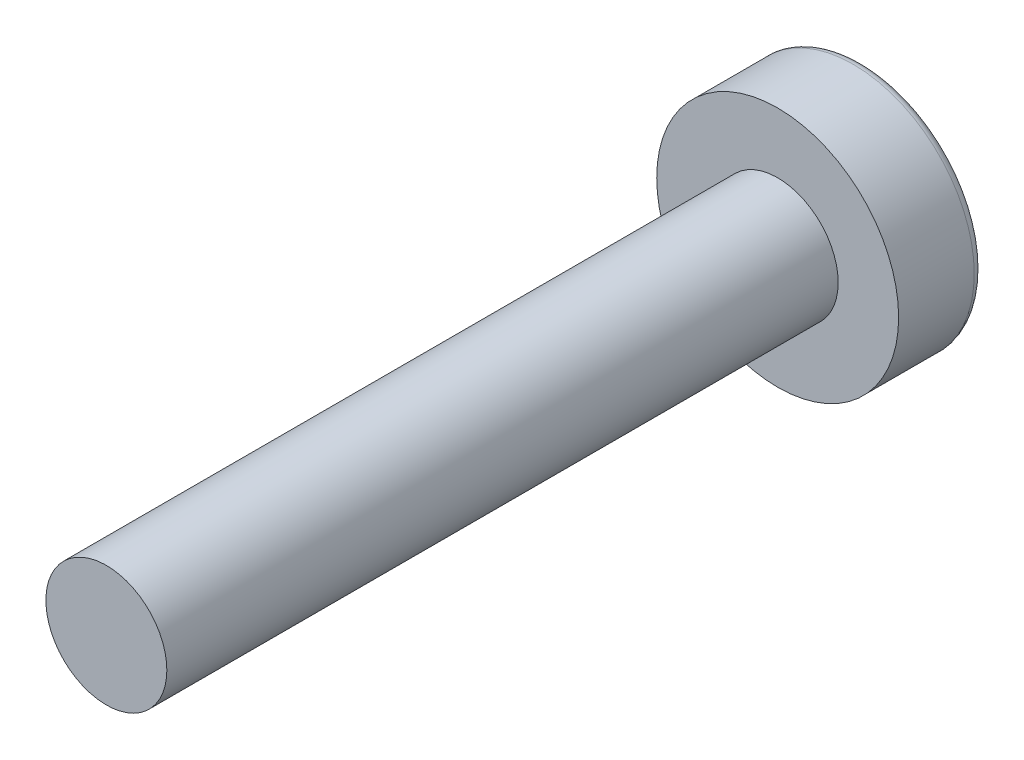
from build123d import *

# Parameters (mm, degrees)
SKETCH_1_R      = 4
EXTRUDE_1_DEPTH = 2.8
SKETCH_2_R      = 2
EXTRUDE_2_DEPTH = 22.2
FILLET_1_R      = 0.3


with BuildPart() as part:
    # 草图1 → 凸台-拉伸1 (new body)
    with BuildSketch(Plane.XY):
        Circle(SKETCH_1_R)
    extrude(amount=EXTRUDE_1_DEPTH)

    # 草图2 → 凸台-拉伸2 (add)
    with BuildSketch(Plane.XY.offset(2.8)):
        Circle(SKETCH_2_R)
    extrude(amount=EXTRUDE_2_DEPTH)

    # 圆角1
    fillet_1_edges = [part.edges().sort_by_distance(p)[0] for p in [
        (-4, 0, 0),
    ]]
    fillet(fillet_1_edges, radius=FILLET_1_R)


solid = part.part
